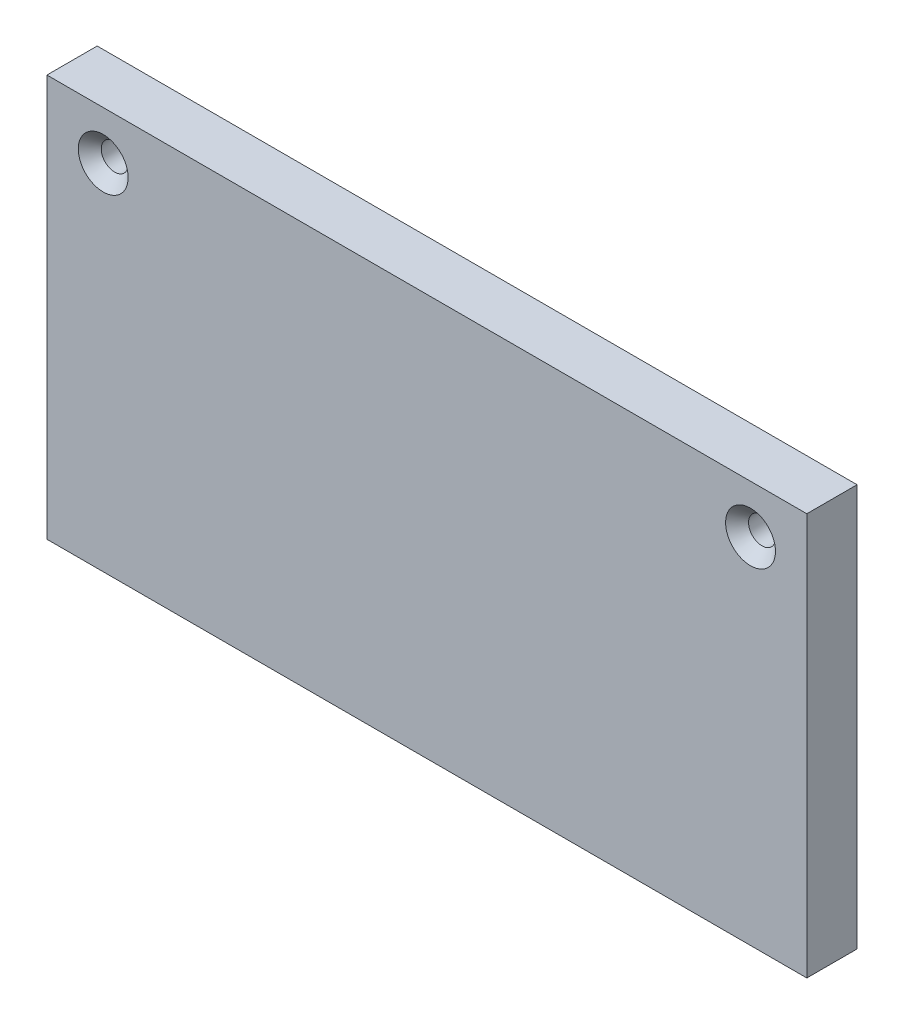
from build123d import *

# Parameters (mm, degrees)
SKETCH1_W                                       = 96.012
SKETCH1_H                                       = 50.8
BOSS_EXTRUDE1_DEPTH                             = 6.35
CSK_FOR_M3_FLAT_HEAD_MACHINE_SCREW2_D           = 3.4
CSK_FOR_M3_FLAT_HEAD_MACHINE_SCREW2_CSINK_D     = 6.3
CSK_FOR_M3_FLAT_HEAD_MACHINE_SCREW2_CSINK_ANGLE = 90


with BuildPart() as part:
    # Sketch1 → Boss-Extrude1 (new body)
    with BuildSketch(Plane.XY):
        with Locations((48.006, 25.4)):
            Rectangle(SKETCH1_W, SKETCH1_H)
    extrude(amount=BOSS_EXTRUDE1_DEPTH)

    # CSK for M3 Flat Head Machine Screw2 (through all)
    with Locations(Plane.XY.offset(6.35)):
        with Locations((7.112, 44.704), (88.9, 44.704)):
            CounterSinkHole(CSK_FOR_M3_FLAT_HEAD_MACHINE_SCREW2_D / 2, CSK_FOR_M3_FLAT_HEAD_MACHINE_SCREW2_CSINK_D / 2, counter_sink_angle=CSK_FOR_M3_FLAT_HEAD_MACHINE_SCREW2_CSINK_ANGLE)


solid = part.part
